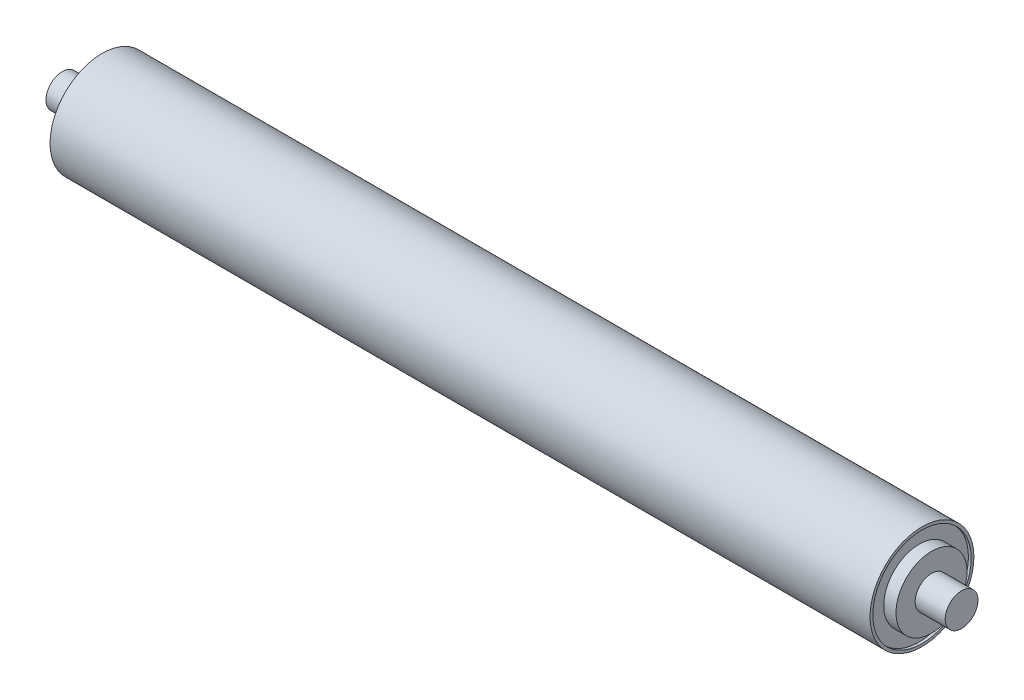
from build123d import *


with BuildPart() as part:
    # 草图1 → 旋转1 (revolve)
    with BuildSketch(Plane.XY, mode=Mode.PRIVATE) as revolve_1_sk:
        Polygon((0, 0), (0, 6), (11, 6), (11, 13), (15.5, 13), (15.5, 18), (14.5, 18), (14.5, 19), (314.5, 19), (314.5, 18), (313.5, 18), (313.5, 13), (318, 13), (318, 6), (329, 6), (329, 0), align=None)
    revolve(revolve_1_sk.sketch.rotate(Axis((329, 0, 0), (1, 0, 0)), 270), axis=Axis((329, 0, 0), (1, 0, 0)))


solid = part.part
